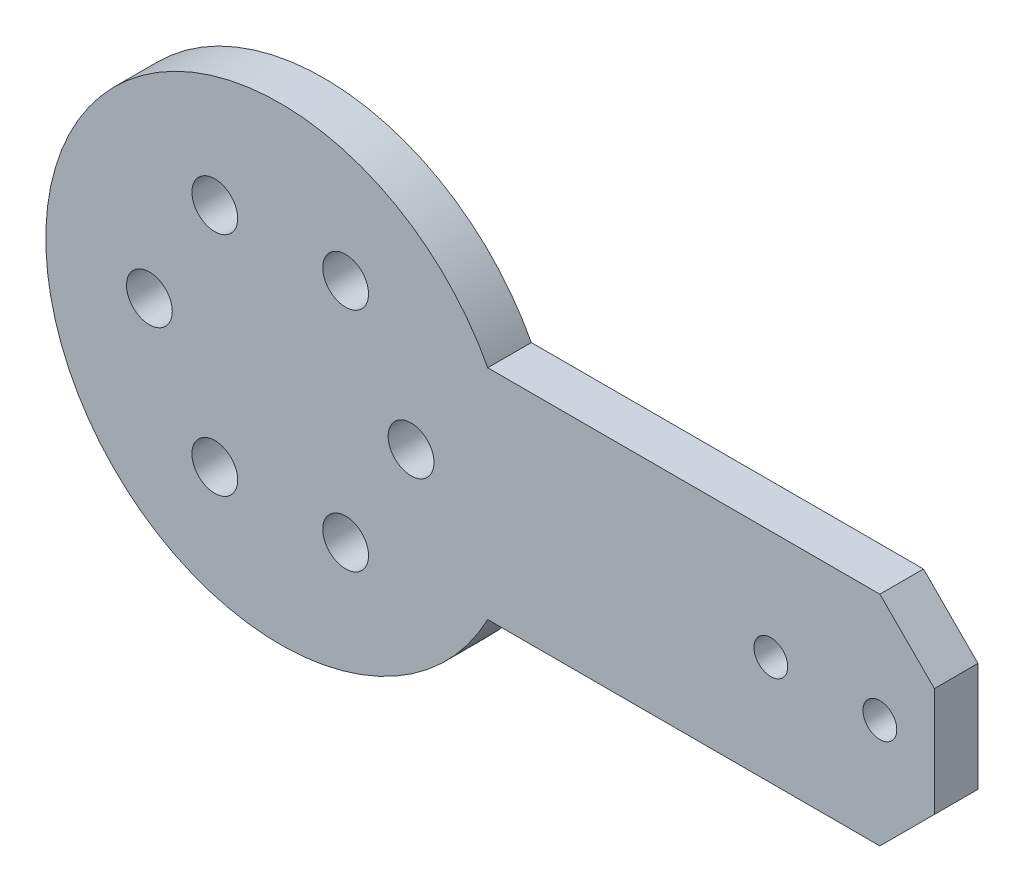
from build123d import *

# Parameters (mm, degrees)
SKETCH_1_R          = 2.1
EXTRUDE_1_DEPTH     = 4
CHAMFER_1_SIZE      = 5
SKETCH_2_R          = 1.55
CUT_EXTRUDE_1_DEPTH = 64.861177565


with BuildPart() as part:
    # 草图1 → 凸台-拉伸1 (new body)
    with BuildSketch(Plane.XY):
        with BuildLine():
            Line((19.032866311, 10), (60, 10))
            Line((60, 10), (60, -10))
            Line((60, -10), (19.032866311, -10))
            ThreePointArc((19.032866311, -10), (-21.5, 0), (19.032866311, 10))
        make_face()
        with Locations((12, 0)):
            Circle(SKETCH_1_R, mode=Mode.SUBTRACT)
        with Locations((6, -10.392304845)):
            Circle(SKETCH_1_R, mode=Mode.SUBTRACT)
        with Locations((-6, -10.392304845)):
            Circle(SKETCH_1_R, mode=Mode.SUBTRACT)
        with Locations((-12, 0)):
            Circle(SKETCH_1_R, mode=Mode.SUBTRACT)
        with Locations((-6, 10.392304845)):
            Circle(SKETCH_1_R, mode=Mode.SUBTRACT)
        with Locations((6, 10.392304845)):
            Circle(SKETCH_1_R, mode=Mode.SUBTRACT)
    extrude(amount=EXTRUDE_1_DEPTH)

    # 倒角1
    chamfer_1_edges = [part.edges().sort_by_distance(p)[0] for p in [
        (60, 10, 2),
        (60, -10, 2),
    ]]
    chamfer(chamfer_1_edges, length=CHAMFER_1_SIZE)

    # 草图2 → 切除-拉伸1 (cut, through all)
    with BuildSketch(Plane.XY.offset(4)):
        with Locations((55, 0)):
            Circle(SKETCH_2_R)
        with Locations((45, 0)):
            Circle(SKETCH_2_R)
    extrude(amount=-CUT_EXTRUDE_1_DEPTH, mode=Mode.SUBTRACT)


solid = part.part
